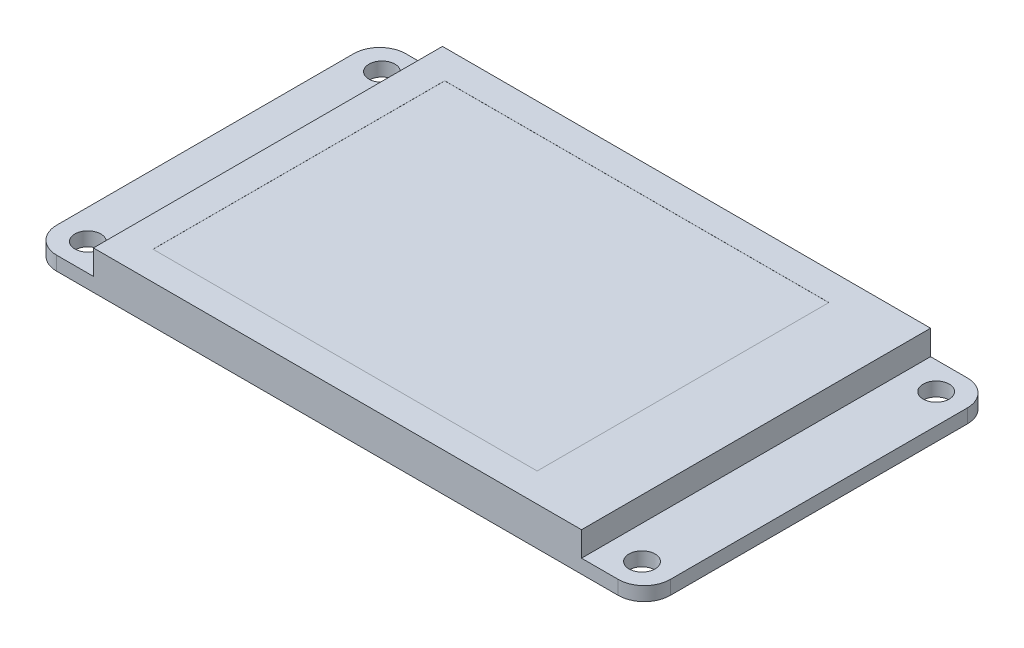
from build123d import *

# Parameters (mm, degrees)
SKETCH_1_W          = 70.65
SKETCH_1_H          = 40.19
EXTRUDE_1_DEPTH     = 1.6
FILLET_1_R          = 3
SKETCH_2_R          = 1.5
CUT_EXTRUDE_1_DEPTH = 1.6
SKETCH_3_W          = 56.2
SKETCH_3_H          = 40.19
EXTRUDE_2_DEPTH     = 2.84
SKETCH_4_W          = 44.23
SKETCH_4_H          = 33.59
CUT_EXTRUDE_2_DEPTH = 0.01


with BuildPart() as part:
    # 草圖1 → 填料-伸長1 (new body)
    with BuildSketch(Plane(origin=(0, 0, 0), x_dir=(1, 0, 0), z_dir=(0, 1, 0))):
        with Locations((-2.656997534, 3.164617756)):
            Rectangle(SKETCH_1_W, SKETCH_1_H)
    extrude(amount=EXTRUDE_1_DEPTH)

    # 圓角1
    fillet_1_edges = [part.edges().sort_by_distance(p)[0] for p in [
        (-37.981997534, 0.8, -23.259617756),
        (32.668002466, 0.8, -23.259617756),
        (32.668002466, 0.8, 16.930382244),
        (-37.981997534, 0.8, 16.930382244),
    ]]
    fillet(fillet_1_edges, radius=FILLET_1_R)

    # 草圖2 → 除料-伸長1 (cut)
    with BuildSketch(Plane(origin=(0, 1.6, 0), x_dir=(1, 0, 0), z_dir=(0, 1, 0))):
        with Locations(Location((-34.561997534, 20.099617756, 0), (0, 0, 270))):
            Circle(SKETCH_2_R)
        with Locations(Location((29.248002466, 20.099617756, 0), (0, 0, 270))):
            Circle(SKETCH_2_R)
        with Locations(Location((-34.561997534, -13.770382244, 0), (0, 0, 270))):
            Circle(SKETCH_2_R)
        with Locations(Location((29.248002466, -13.770382244, 0), (0, 0, 270))):
            Circle(SKETCH_2_R)
    extrude(amount=-CUT_EXTRUDE_1_DEPTH, mode=Mode.SUBTRACT)

    # 草圖3 → 填料-伸長2 (add)
    with BuildSketch(Plane(origin=(0, 1.6, 0), x_dir=(1, 0, 0), z_dir=(0, 1, 0))):
        with Locations((-2.656997534, 3.164617756)):
            Rectangle(SKETCH_3_W, SKETCH_3_H)
    extrude(amount=EXTRUDE_2_DEPTH)

    # 草圖4 → 除料-伸長2 (cut)
    with BuildSketch(Plane(origin=(0, 4.44, 0), x_dir=(1, 0, 0), z_dir=(0, 1, 0))):
        with Locations((-5.081997534, 3.164617756)):
            Rectangle(SKETCH_4_W, SKETCH_4_H)
    extrude(amount=-CUT_EXTRUDE_2_DEPTH, mode=Mode.SUBTRACT)


solid = part.part
